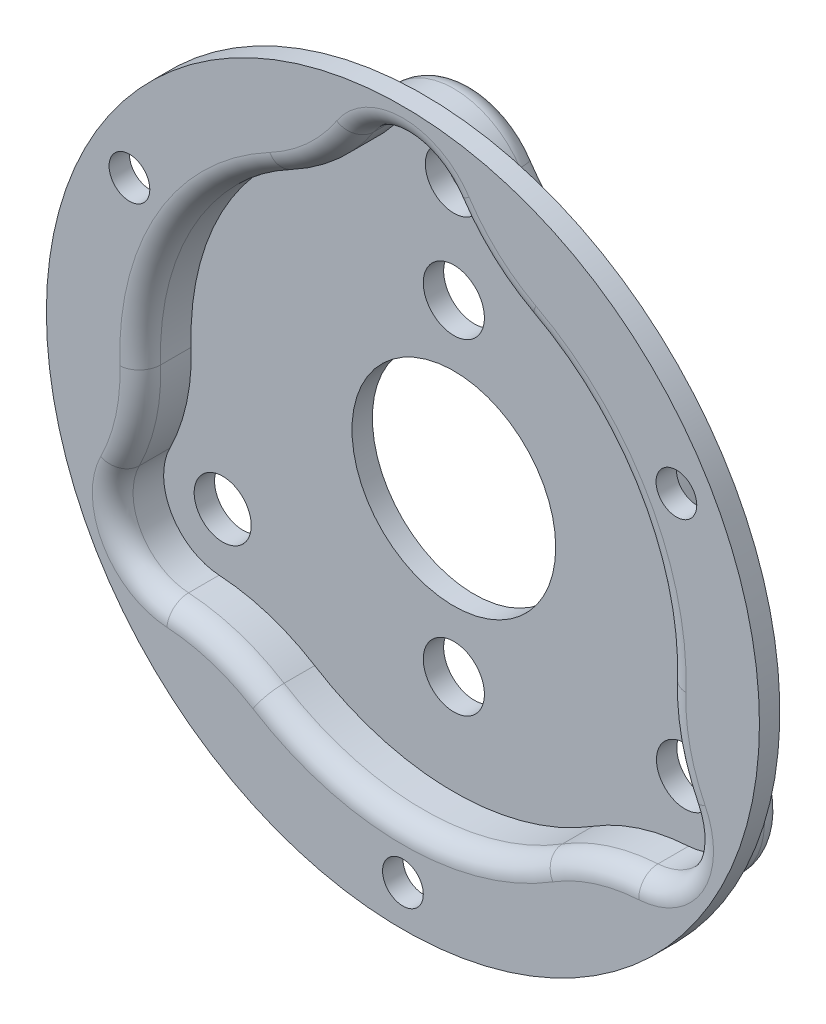
from build123d import *

# Parameters (mm, degrees)
SKETCH_1_R          = 17.5
EXTRUDE_1_DEPTH     = 3.5
CUT_EXTRUDE_1_DEPTH = 2.5
FILLET_1_R          = 10
SKETCH_3_R          = 17.5
CUT_EXTRUDE_2_DEPTH = 2.5
FILLET_2_R          = 1
FILLET_3_R          = 1
SKETCH_4_R          = 1.4
SKETCH_4_R_2        = 1
SKETCH_4_R_3        = 1.5
SKETCH_4_R_4        = 5
CUT_EXTRUDE_3_DEPTH = 25.99499964


with BuildPart() as part:
    # ｽｹｯﾁ1 → ﾎﾞｽ - 押し出し1 (new body)
    with BuildSketch(Plane.XY):
        Circle(SKETCH_1_R)
    extrude(amount=EXTRUDE_1_DEPTH)

    # ｽｹｯﾁ2 → ｶｯﾄ - 押し出し1 (cut)
    with BuildSketch(Plane.XY.offset(3.5)):
        with BuildLine():
            ThreePointArc((-2.853095764, 12.580534351), (-11.171727709, 6.45), (-12.321610223, -3.819413764))
            ThreePointArc((-12.321610223, -3.819413764), (-13.856406461, -8), (-9.468514459, -8.761120587))
            ThreePointArc((-9.468514459, -8.761120587), (0, -12.9), (9.468514459, -8.761120587))
            ThreePointArc((9.468514459, -8.761120587), (13.856406461, -8), (12.321610223, -3.819413764))
            ThreePointArc((12.321610223, -3.819413764), (11.171727709, 6.45), (2.853095764, 12.580534351))
            ThreePointArc((2.853095764, 12.580534351), (0, 16), (-2.853095764, 12.580534351))
        make_face()
    extrude(amount=-CUT_EXTRUDE_1_DEPTH, mode=Mode.SUBTRACT)

    # ﾌｨﾚｯﾄ1
    fillet_1_edges = [part.edges().sort_by_distance(p)[0] for p in [
        (2.853095764, 12.580534351, 2.25),
        (12.321610223, -3.819413764, 2.25),
        (9.468514459, -8.761120587, 2.25),
        (-9.468514459, -8.761120587, 2.25),
        (-12.321610223, -3.819413764, 2.25),
        (-2.853095764, 12.580534351, 2.25),
    ]]
    fillet(fillet_1_edges, radius=FILLET_1_R)

    # ｽｹｯﾁ3 → ｶｯﾄ - 押し出し2 (cut)
    with BuildSketch(Plane(origin=(0, 0, 0), x_dir=(-1, 0, 0), z_dir=(0, 0, -1))):
        Circle(SKETCH_3_R)
        with BuildLine():
            ThreePointArc((11.580900059, -10.442854922), (14.722431864, -8.5), (14.834227681, -4.807926189))
            ThreePointArc((14.834227681, -4.807926189), (14.092365761, -2.7019505), (13.8917733, -0.478157484))
            ThreePointArc((13.8917733, -0.478157484), (12.037753113, 6.95), (6.531790122, 12.269707324))
            ThreePointArc((6.531790122, 12.269707324), (4.706225108, 13.555321998), (3.253327621, 15.250781111))
            ThreePointArc((3.253327621, 15.250781111), (0, 17), (-3.253327621, 15.250781111))
            ThreePointArc((-3.253327621, 15.250781111), (-4.706225108, 13.555321998), (-6.531790122, 12.269707324))
            ThreePointArc((-6.531790122, 12.269707324), (-12.037753113, 6.95), (-13.8917733, -0.478157484))
            ThreePointArc((-13.8917733, -0.478157484), (-14.092365761, -2.7019505), (-14.834227681, -4.807926189))
            ThreePointArc((-14.834227681, -4.807926189), (-14.722431864, -8.5), (-11.580900059, -10.442854922))
            ThreePointArc((-11.580900059, -10.442854922), (-9.386140653, -10.853371498), (-7.359983178, -11.791549839))
            ThreePointArc((-7.359983178, -11.791549839), (0, -13.9), (7.359983178, -11.791549839))
            ThreePointArc((7.359983178, -11.791549839), (9.386140653, -10.853371498), (11.580900059, -10.442854922))
        make_face(mode=Mode.SUBTRACT)
    extrude(amount=-CUT_EXTRUDE_2_DEPTH, mode=Mode.SUBTRACT)

    # ﾌｨﾚｯﾄ2
    fillet_2_edges = [part.edges().sort_by_distance(p)[0] for p in [
        (-13.856406461, -8, 3.5),
        (0, -12.9, 3.5),
        (-11.171727709, 6.45, 3.5),
        (0, 16, 3.5),
        (11.171727709, 6.45, 3.5),
        (13.856406461, -8, 3.5),
        (-4.033471592, 12.815455316, 3.5),
        (4.033471592, 12.815455316, 3.5),
        (13.115245661, -2.914638794, 3.5),
        (9.081774068, -9.900816522, 3.5),
        (-9.081774068, -9.900816522, 3.5),
        (-13.115245661, -2.914638794, 3.5),
    ]]
    fillet(fillet_2_edges, radius=FILLET_2_R)

    # ﾌｨﾚｯﾄ3
    fillet_3_edges = [part.edges().sort_by_distance(p)[0] for p in [
        (-9.386140653, -10.853371498, 0),
        (0, -13.9, 0),
        (9.386140653, -10.853371498, 0),
        (14.722431864, -8.5, 0),
        (14.092365761, -2.7019505, 0),
        (12.037753113, 6.95, 0),
        (4.706225108, 13.555321998, 0),
        (0, 17, 0),
        (-4.706225108, 13.555321998, 0),
        (-12.037753113, 6.95, 0),
        (-14.092365761, -2.7019505, 0),
        (-14.722431864, -8.5, 0),
    ]]
    fillet(fillet_3_edges, radius=FILLET_3_R)

    # ｽｹｯﾁ4 → ｶｯﾄ - 押し出し3 (cut, through all)
    with BuildSketch(Plane.XY.offset(3.5)):
        with Locations((0, 13.1)):
            Circle(SKETCH_4_R)
        with Locations((0, -15.5)):
            Circle(SKETCH_4_R_2)
        with Locations((11.34493279, -6.55)):
            Circle(SKETCH_4_R)
        with Locations((-13.423393759, 7.75)):
            Circle(SKETCH_4_R_2)
        with Locations((-11.34493279, -6.55)):
            Circle(SKETCH_4_R)
        with Locations((13.423393759, 7.75)):
            Circle(SKETCH_4_R_2)
        with Locations((0, 8)):
            Circle(SKETCH_4_R_3)
        Circle(SKETCH_4_R_4)
        with Locations((0, -8)):
            Circle(SKETCH_4_R_3)
    extrude(amount=-CUT_EXTRUDE_3_DEPTH, mode=Mode.SUBTRACT)


solid = part.part
